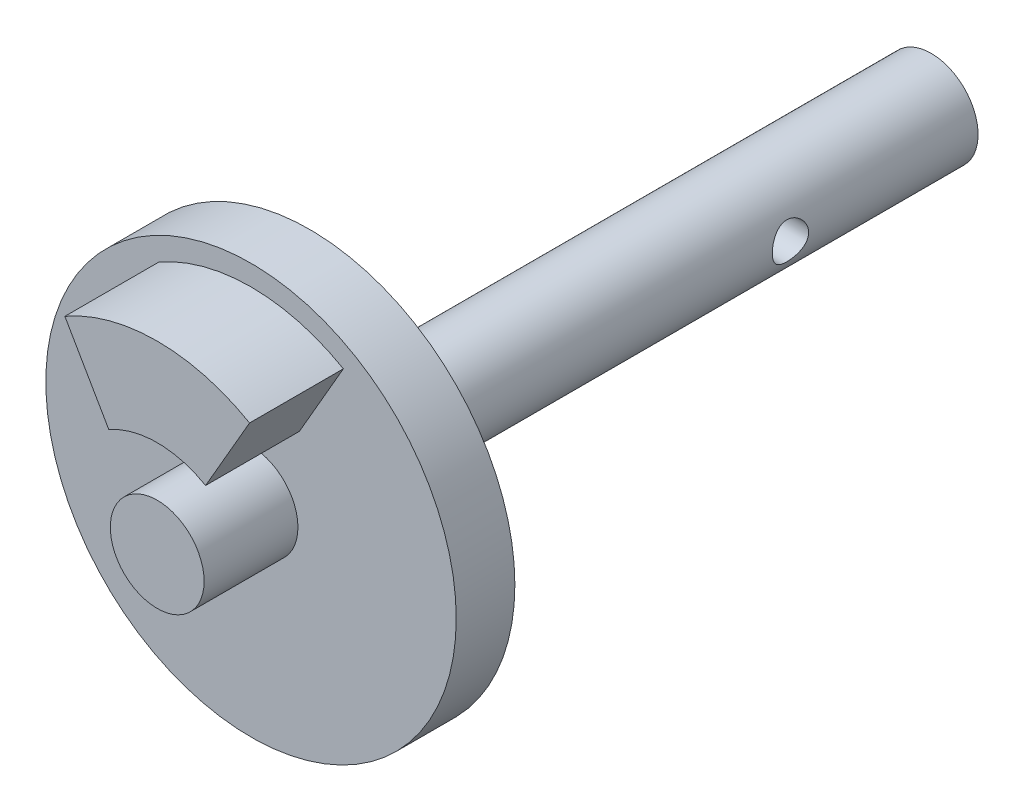
from build123d import *

# Parameters (mm, degrees)
SKETCH1_R                           = 17.5
BOSS_EXTRUDE1_DEPTH                 = 2.5
BOSS_EXTRUDE2_DEPTH                 = 8
SKETCH3_R                           = 4
BOSS_EXTRUDE3_DEPTH                 = 8
BOSS_EXTRUDE4_START                 = 53
SKETCH7_R                           = 4
BOSS_EXTRUDE4_DEPTH                 = 53
CUT_EXTRUDE1_REACH                  = 62.768
CUT_EXTRUDE1_END_RADIUS             = 4
SKETCH8_R                           = 1.55
CUT_EXTRUDE1_DIRECTION_2_REACH      = 62.768
CUT_EXTRUDE1_DIRECTION_2_END_RADIUS = 4


with BuildPart() as part:
    # Sketch1 → Boss-Extrude1 (new, symmetric)
    with BuildSketch(Plane.XY):
        Circle(SKETCH1_R)
    extrude(amount=BOSS_EXTRUDE1_DEPTH, both=True)

    # Sketch2 → Boss-Extrude2 (add)
    with BuildSketch(Plane.XY.offset(2.5)):
        with BuildLine():
            Line((7.875, 13.63990011), (4.125, 7.144709581))
            ThreePointArc((4.125, 7.144709581), (0, 8.25), (-4.125, 7.144709581))
            Line((-4.125, 7.144709581), (-7.875, 13.63990011))
            ThreePointArc((-7.875, 13.63990011), (0, 15.75), (7.875, 13.63990011))
        make_face()
    extrude(amount=BOSS_EXTRUDE2_DEPTH)

    # Sketch3 → Boss-Extrude3 (add)
    with BuildSketch(Plane.XY.offset(2.5)):
        Circle(SKETCH3_R)
    extrude(amount=BOSS_EXTRUDE3_DEPTH)

    # Sketch7 → Boss-Extrude4 (add)
    with BuildSketch(Plane(origin=(0, 0, -2.5), x_dir=(-1, 0, 0), z_dir=(0, 0, -1)).offset(BOSS_EXTRUDE4_START)):
        Circle(SKETCH7_R)
    extrude(amount=-BOSS_EXTRUDE4_DEPTH)

    # Cut-Extrude1: up to this cylinder (the profile starts inside it)
    cut_extrude1_end = Plane(origin=(0, 0, -39.5), z_dir=(0, 0, 1)) * Cylinder(CUT_EXTRUDE1_END_RADIUS, 134.536, mode=Mode.PRIVATE)
    # Sketch8 → Cut-Extrude1 (cut, up to the surface)
    with BuildSketch(Plane.ZY, mode=Mode.PRIVATE) as cut_extrude1_sk1:
        with Locations((-39.5, 0)):
            Circle(SKETCH8_R)
    cut_extrude1_tool1 = extrude(cut_extrude1_sk1.sketch, amount=-CUT_EXTRUDE1_REACH, mode=Mode.PRIVATE) & cut_extrude1_end
    add(cut_extrude1_tool1.solids().sort_by_distance((0, 0, -39.5))[0], mode=Mode.SUBTRACT)

    # Cut-Extrude1 direction 2: up to this cylinder (the profile starts inside it)
    cut_extrude1_direction_2_end = Plane(origin=(0, 0, -39.5), z_dir=(0, 0, 1)) * Cylinder(CUT_EXTRUDE1_DIRECTION_2_END_RADIUS, 134.536, mode=Mode.PRIVATE)
    # Sketch8 → Cut-Extrude1 direction 2 (cut, up to the surface)
    with BuildSketch(Plane.ZY, mode=Mode.PRIVATE) as cut_extrude1_direction_2_sk1:
        with Locations((-39.5, 0)):
            Circle(SKETCH8_R)
    cut_extrude1_direction_2_tool1 = extrude(cut_extrude1_direction_2_sk1.sketch, amount=CUT_EXTRUDE1_DIRECTION_2_REACH, mode=Mode.PRIVATE) & cut_extrude1_direction_2_end
    add(cut_extrude1_direction_2_tool1.solids().sort_by_distance((0, 0, -39.5))[0], mode=Mode.SUBTRACT)


solid = part.part
